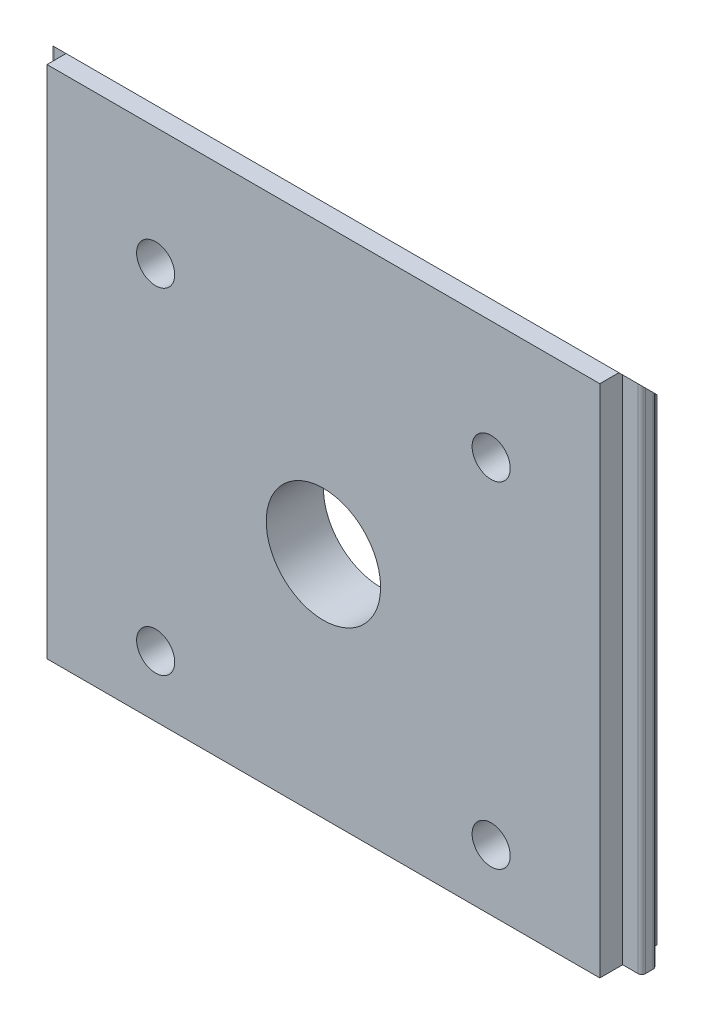
from build123d import *

# Parameters (mm, degrees)
SKETCH1_W           = 36.83
SKETCH1_H           = 34.29
BOSS_EXTRUDE1_DEPTH = 3.81
SKETCH2_W           = 1.016
SKETCH2_H           = 34.29
BOSS_EXTRUDE2_DEPTH = 1.27
FILLET1_R           = 0.254
SKETCH3_R           = 3.81
SKETCH3_R_2         = 1.27
CUT_EXTRUDE1_DEPTH  = 3.81
CHAMFER1_SIZE       = 2.54


with BuildPart() as part:
    # Sketch1 → Boss-Extrude1 (new body)
    with BuildSketch(Plane.XY):
        Rectangle(SKETCH1_W, SKETCH1_H)
    extrude(amount=BOSS_EXTRUDE1_DEPTH)

    # Sketch2 → Boss-Extrude2 (add)
    with BuildSketch(Plane(origin=(18.415, 0, 0), x_dir=(0, 0, -1), z_dir=(1, 0, 0))):
        with Locations((-1.778, 0)):
            Rectangle(SKETCH2_W, SKETCH2_H)
    boss_extrude2 = extrude(amount=BOSS_EXTRUDE2_DEPTH)

    # Mirror1: Boss-Extrude2 across plane
    add(boss_extrude2.mirror(Plane(origin=(0, 0, 0), x_dir=(0, 0, 1), z_dir=(1, 0, 0))))

    # Fillet1
    fillet1_edges = [part.edges().sort_by_distance(p)[0] for p in [
        (19.685, 0, 2.286),
        (19.685, 0, 1.27),
        (-19.685, 0, 2.286),
        (-19.685, 0, 1.27),
    ]]
    fillet(fillet1_edges, radius=FILLET1_R)

    # Sketch3 → Cut-Extrude1 (cut)
    with BuildSketch(Plane.XY.offset(3.81)):
        with Locations((0, -1.905)):
            Circle(SKETCH3_R)
        with Locations((-11.176, 9.271)):
            Circle(SKETCH3_R_2)
        with Locations((11.176, 9.271)):
            Circle(SKETCH3_R_2)
        with Locations((11.176, -13.081)):
            Circle(SKETCH3_R_2)
        with Locations((-11.176, -13.081)):
            Circle(SKETCH3_R_2)
    extrude(amount=-CUT_EXTRUDE1_DEPTH, mode=Mode.SUBTRACT)

    # Chamfer1
    chamfer1_edges = [part.edges().sort_by_distance(p)[0] for p in [
        (0, 17.145, 0),
    ]]
    chamfer(chamfer1_edges, length=CHAMFER1_SIZE)


solid = part.part
